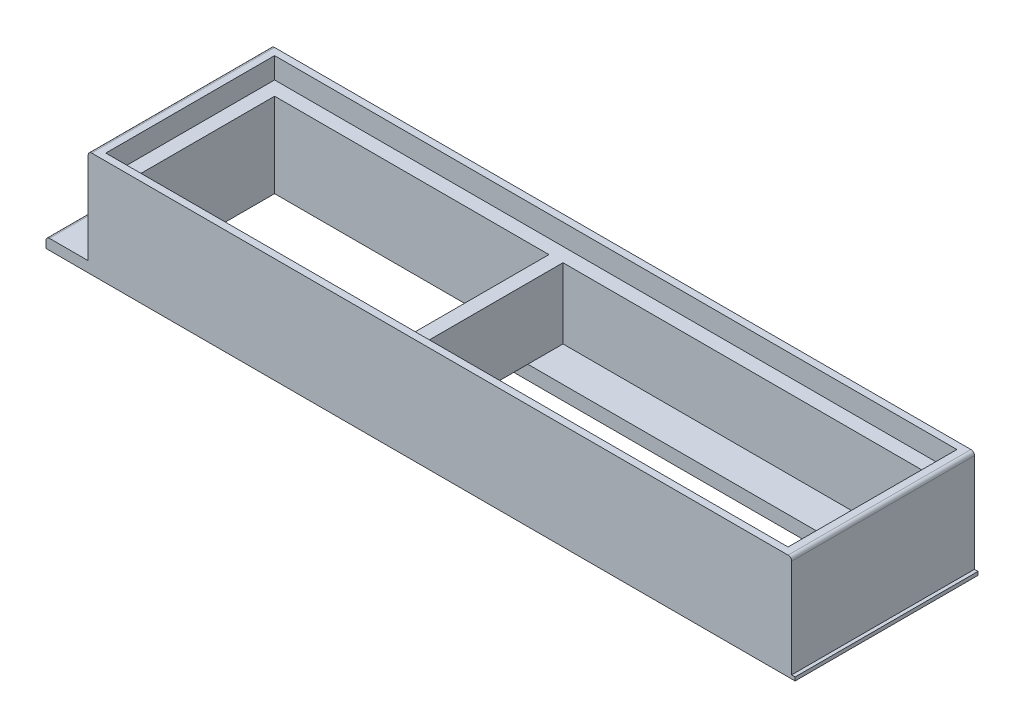
from build123d import *

# Parameters (mm, degrees)
SKETCH1_W                                           = 107
SKETCH1_H                                           = 26
BOSS_EXTRUDE1_DEPTH                                 = 15
SKETCH2_W                                           = 1
SKETCH2_H                                           = 14.5
SKETCH2_W_2                                         = 6
SKETCH2_H_2                                         = 13.5
CUT_EXTRUDE1_DEPTH                                  = 112.130553854
FILLET1_R                                           = 0.5
CSK_FOR_M2_COUNTERSUNK_FLAT_HEAD_SCREW1_D           = 2.4
CSK_FOR_M2_COUNTERSUNK_FLAT_HEAD_SCREW1_DEPTH       = 15
CSK_FOR_M2_COUNTERSUNK_FLAT_HEAD_SCREW1_CSINK_D     = 4.4
CSK_FOR_M2_COUNTERSUNK_FLAT_HEAD_SCREW1_CSINK_ANGLE = 90
CSK_FOR_M2_COUNTERSUNK_FLAT_HEAD_SCREW1_TIP         = 0.721032743
SKETCH14_W                                          = 97
SKETCH14_H                                          = 24
CUT_EXTRUDE7_DEPTH                                  = 112.130553854
SKETCH14_3_W                                        = 97
SKETCH14_3_H                                        = 24
BOSS_EXTRUDE3_DEPTH                                 = 1
SKETCH18_W                                          = 97
SKETCH18_H                                          = 24
CUT_EXTRUDE8_DEPTH                                  = 112.130553854
SKETCH20_W                                          = 97
SKETCH20_H                                          = 24
SKETCH20_W_2                                        = 93
SKETCH20_H_2                                        = 20
BOSS_EXTRUDE4_DEPTH                                 = 15
SKETCH20_2_W                                        = 97
SKETCH20_2_H                                        = 24
SKETCH20_2_W_2                                      = 93
SKETCH20_2_H_2                                      = 20
CUT_EXTRUDE9_DEPTH                                  = 3
SKETCH21_W                                          = 52
SKETCH21_H                                          = 2
BOSS_EXTRUDE5_DEPTH                                 = 5
SKETCH22_W                                          = 52
SKETCH22_H                                          = 2
BOSS_EXTRUDE6_DEPTH                                 = 5
SKETCH23_W                                          = 0.5
SKETCH23_H                                          = 16.612240618
CUT_EXTRUDE10_DEPTH                                 = 112.130553854
BOSS_EXTRUDE7_REACH                                 = 111.983
SKETCH25_W                                          = 2
SKETCH25_H                                          = 12
CUT_EXTRUDE11_REACH                                 = 65.537
SKETCH26_W                                          = 10
SKETCH26_H                                          = 2


with BuildPart() as part:
    # Sketch1 → Boss-Extrude1 (new body)
    with BuildSketch(Plane(origin=(0, 0, 0), x_dir=(1, 0, 0), z_dir=(0, 1, 0))):
        with Locations((53.5, -13)):
            Rectangle(SKETCH1_W, SKETCH1_H)
    extrude(amount=BOSS_EXTRUDE1_DEPTH)

    # Sketch2 → Cut-Extrude1 (cut, through all)
    with BuildSketch(Plane.XY.offset(26)):
        with Locations((106.5, 7.75)):
            Rectangle(SKETCH2_W, SKETCH2_H)
        with Locations((3, 8.25)):
            Rectangle(SKETCH2_W_2, SKETCH2_H_2)
    extrude(amount=-CUT_EXTRUDE1_DEPTH, mode=Mode.SUBTRACT)

    # Fillet1
    fillet1_edges = [part.edges().sort_by_distance(p)[0] for p in [
        (106, 15, 13),
        (0, 1.5, 13),
        (6, 15, 13),
    ]]
    fillet(fillet1_edges, radius=FILLET1_R)

    # CSK for M2 Countersunk Flat Head Screw1
    with Locations(Plane(origin=(3, 1.5, 13), x_dir=(1, 0, 0), z_dir=(0, 1, 0))):
        with Locations((0, 0)):
            CounterSinkHole(CSK_FOR_M2_COUNTERSUNK_FLAT_HEAD_SCREW1_D / 2, CSK_FOR_M2_COUNTERSUNK_FLAT_HEAD_SCREW1_CSINK_D / 2, depth=CSK_FOR_M2_COUNTERSUNK_FLAT_HEAD_SCREW1_DEPTH, counter_sink_angle=CSK_FOR_M2_COUNTERSUNK_FLAT_HEAD_SCREW1_CSINK_ANGLE)
            with Locations((0, 0, -(CSK_FOR_M2_COUNTERSUNK_FLAT_HEAD_SCREW1_DEPTH + CSK_FOR_M2_COUNTERSUNK_FLAT_HEAD_SCREW1_TIP / 2))):  # 118° drill point
                Cone(0, CSK_FOR_M2_COUNTERSUNK_FLAT_HEAD_SCREW1_D / 2, CSK_FOR_M2_COUNTERSUNK_FLAT_HEAD_SCREW1_TIP, mode=Mode.SUBTRACT)

    # Sketch14 → Cut-Extrude7 (cut, through all)
    with BuildSketch(Plane(origin=(0, 15, 0), x_dir=(1, 0, 0), z_dir=(0, 1, 0))):
        with Locations((56, -13)):
            Rectangle(SKETCH14_W, SKETCH14_H)
    extrude(amount=-CUT_EXTRUDE7_DEPTH, mode=Mode.SUBTRACT)

    # Sketch14<3> → Boss-Extrude3 (add)
    with BuildSketch(Plane(origin=(0, 15, 0), x_dir=(1, 0, 0), z_dir=(0, 1, 0))):
        with Locations((56, -13)):
            Rectangle(SKETCH14_3_W, SKETCH14_3_H)
    extrude(amount=-BOSS_EXTRUDE3_DEPTH)

    # Sketch18 → Cut-Extrude8 (cut, through all)
    with BuildSketch(Plane(origin=(0, 0, 0), x_dir=(1, 0, 0), z_dir=(0, 1, 0))):
        with Locations((56, -13)):
            Rectangle(SKETCH18_W, SKETCH18_H)
    extrude(amount=CUT_EXTRUDE8_DEPTH, mode=Mode.SUBTRACT)

    # Sketch20 → Boss-Extrude4 (add)
    with BuildSketch(Plane(origin=(0, 15, 0), x_dir=(1, 0, 0), z_dir=(0, 1, 0))):
        with Locations((56, -13)):
            Rectangle(SKETCH20_W, SKETCH20_H)
        with Locations((56, -13)):
            Rectangle(SKETCH20_W_2, SKETCH20_H_2, mode=Mode.SUBTRACT)
    extrude(amount=-BOSS_EXTRUDE4_DEPTH)

    # Sketch20<2> → Cut-Extrude9 (cut)
    with BuildSketch(Plane(origin=(0, 15, 0), x_dir=(1, 0, 0), z_dir=(0, 1, 0))):
        with Locations((56, -13)):
            Rectangle(SKETCH20_2_W, SKETCH20_2_H)
        with Locations((56, -13)):
            Rectangle(SKETCH20_2_W_2, SKETCH20_2_H_2, mode=Mode.SUBTRACT)
    extrude(amount=-CUT_EXTRUDE9_DEPTH, mode=Mode.SUBTRACT)

    # Sketch21 → Boss-Extrude5 (add)
    with BuildSketch(Plane.XY.offset(3)):
        with Locations((76.5, 1)):
            Rectangle(SKETCH21_W, SKETCH21_H)
    extrude(amount=BOSS_EXTRUDE5_DEPTH)

    # Sketch22 → Boss-Extrude6 (add)
    with BuildSketch(Plane(origin=(0, 0, 23), x_dir=(-1, 0, 0), z_dir=(0, 0, -1))):
        with Locations((-76.5, 1)):
            Rectangle(SKETCH22_W, SKETCH22_H)
    extrude(amount=BOSS_EXTRUDE6_DEPTH)

    # Sketch23 → Cut-Extrude10 (cut, through all)
    with BuildSketch(Plane.XY.offset(26)):
        with Locations((106.75, 8.306120309)):
            Rectangle(SKETCH23_W, SKETCH23_H)
    extrude(amount=-CUT_EXTRUDE10_DEPTH, mode=Mode.SUBTRACT)

    # Sketch25 → Boss-Extrude7 (add, up to next)
    with BuildSketch(Plane(origin=(0, 0, 23), x_dir=(-1, 0, 0), z_dir=(0, 0, -1)), mode=Mode.PRIVATE) as boss_extrude7_sk1:
        with Locations((-49.5, 6)):
            Rectangle(SKETCH25_W, SKETCH25_H)
    boss_extrude7_tool1 = extrude(boss_extrude7_sk1.sketch, amount=BOSS_EXTRUDE7_REACH, mode=Mode.PRIVATE) - part.part
    add(boss_extrude7_tool1.solids().sort_by_distance((49.5, 6, 23))[0])

    # Sketch26 → Cut-Extrude11 (cut, up to next)
    with BuildSketch(Plane(origin=(50.5, 0, 0), x_dir=(0, 0, -1), z_dir=(1, 0, 0)), mode=Mode.PRIVATE) as cut_extrude11_sk1:
        with Locations((-13, 1)):
            Rectangle(SKETCH26_W, SKETCH26_H)
    cut_extrude11_tool1 = extrude(cut_extrude11_sk1.sketch, amount=-CUT_EXTRUDE11_REACH, mode=Mode.PRIVATE) & part.part
    add(cut_extrude11_tool1.solids().sort_by_distance((50.5, 1, 13))[0], mode=Mode.SUBTRACT)


solid = part.part
